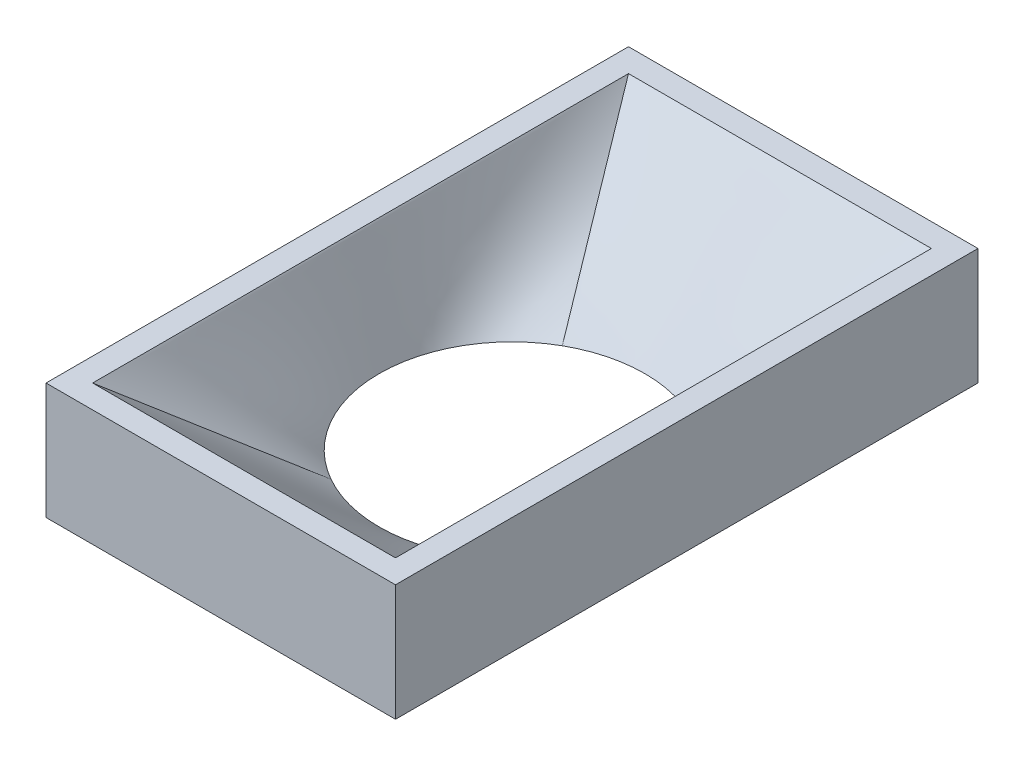
from build123d import *

# Parameters (mm, degrees)
SKETCH1_W           = 38.1
SKETCH1_H           = 63.5
BOSS_EXTRUDE1_DEPTH = 12.7


with BuildPart() as part:
    # Sketch1 → Boss-Extrude1 (new body)
    with BuildSketch(Plane(origin=(0, 0, 0), x_dir=(1, 0, 0), z_dir=(0, 1, 0))):
        Rectangle(SKETCH1_W, SKETCH1_H)
    extrude(amount=BOSS_EXTRUDE1_DEPTH)

    # Sketch2 for Cut-Loft1 → Cut-Loft1 section 0
    with BuildSketch(Plane.XZ):
        with BuildLine():
            # circular arc as an exact rational Bezier (weights 1, cos(half-angle), 1)
            Bezier((-7.124004962, 12.604008779), (0, 16.630620279), (7.124004962, 12.604008779), weights=[1, 0.870562839, 1])
            Bezier((7.124004962, 12.604008779), (29.42340511, 0), (7.124004962, -12.604008779), weights=[1, 0.492057257, 1])
            Bezier((7.124004962, -12.604008779), (0, -16.630620279), (-7.124004962, -12.604008779), weights=[1, 0.870562839, 1])
            Bezier((-7.124004962, -12.604008779), (-29.42340511, 0), (-7.124004962, 12.604008779), weights=[1, 0.492057257, 1])
        make_face()
    # Sketch4 → Cut-Loft1 section 1
    with BuildSketch(Plane(origin=(0, 12.7, 0), x_dir=(1, 0, 0), z_dir=(0, 1, 0))):
        with BuildLine():
            Line((-16.51, -29.21), (16.51, -29.21))
            Line((16.51, -29.21), (16.51, 29.21))
            Line((16.51, 29.21), (-16.51, 29.21))
            Line((-16.51, 29.21), (-16.51, -29.21))
        make_face()
    loft(mode=Mode.SUBTRACT)


solid = part.part
